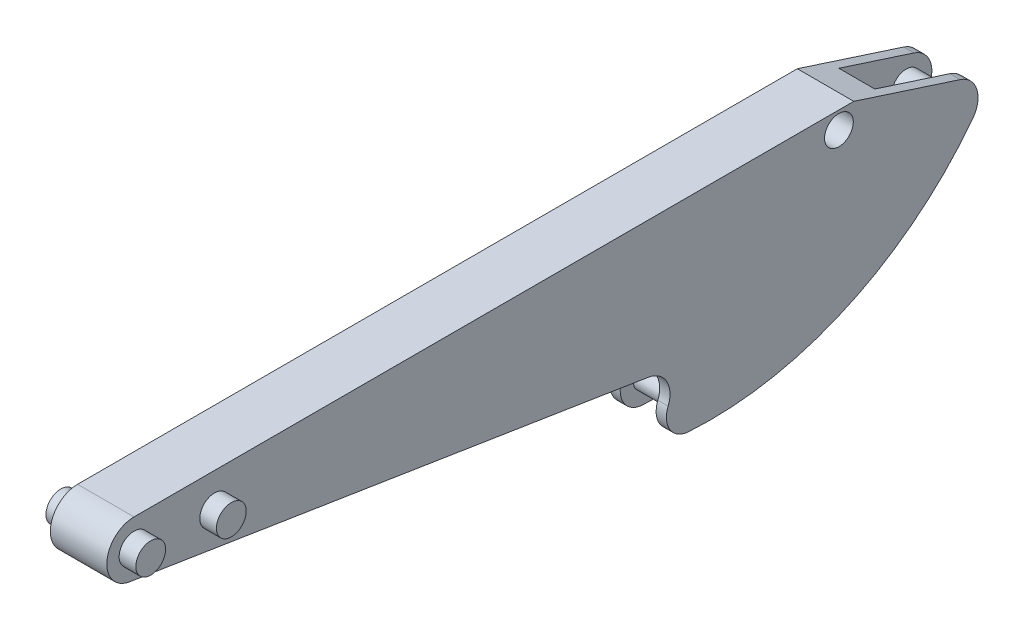
from build123d import *

# Parameters (mm, degrees)
SKETCH1_R           = 28
BOSS_EXTRUDE1_DEPTH = 55
CUT_EXTRUDE1_DEPTH  = 35
SKETCH3_R           = 28
SKETCH3_R_2         = 20
BOSS_EXTRUDE2_DEPTH = 35
SKETCH4_R           = 29
BOSS_EXTRUDE3_DEPTH = 87.5


with BuildPart() as part:
    # Sketch1 → Boss-Extrude1 (new, symmetric)
    with BuildSketch(Plane(origin=(0, 0, 0), x_dir=(0, 0, -1), z_dir=(1, 0, 0))):
        with BuildLine():
            ThreePointArc((1633.779443993, -91.870179926), (1388.538518192, -287.439228591), (1079.911873115, -343.474560585))
            ThreePointArc((1079.911873115, -343.474560585), (1044.034822803, -322.026545424), (1040.331298925, -280.391656157))
            ThreePointArc((1040.331298925, -280.391656157), (1037.457004109, -237.066241511), (1001.77399927, -212.326065873))
            Line((1001.77399927, -212.326065873), (-8.291026647, -52.347482052))
            ThreePointArc((-8.291026647, -52.347482052), (-52.836618688, 4.158332074), (0, 53))
            Line((0, 53), (1402, 53))
            Line((1402, 53), (1609.372117166, -14))
            ThreePointArc((1609.372117166, -14), (1641.711266017, -46.623901593), (1633.779443993, -91.870179926))
        make_face()
        with Locations((1373, 19)):
            Circle(SKETCH1_R, mode=Mode.SUBTRACT)
    extrude(amount=BOSS_EXTRUDE1_DEPTH, both=True)

    # Sketch2 → Cut-Extrude1 (cut, symmetric)
    with BuildSketch(Plane(origin=(0, 0, 0), x_dir=(0, 0, -1), z_dir=(1, 0, 0))):
        with BuildLine():
            Line((1462.900269506, 33.323690028), (1249.391694757, -251.544855987))
            Line((1249.391694757, -251.544855987), (1001.77399927, -212.326065873))
            ThreePointArc((1001.77399927, -212.326065873), (1037.457004109, -237.066241511), (1040.331298925, -280.391656157))
            ThreePointArc((1040.331298925, -280.391656157), (1044.034822803, -322.026545424), (1079.911873115, -343.474560585))
            ThreePointArc((1079.911873115, -343.474560585), (1388.538518192, -287.439228591), (1633.779443993, -91.870179926))
            ThreePointArc((1633.779443993, -91.870179926), (1641.711266017, -46.623901593), (1609.372117166, -14))
            Line((1609.372117166, -14), (1462.900269506, 33.323690028))
        make_face()
    extrude(amount=CUT_EXTRUDE1_DEPTH, both=True, mode=Mode.SUBTRACT)

    # Sketch3 → Boss-Extrude2 (add, symmetric)
    with BuildSketch(Plane(origin=(0, 0, 0), x_dir=(0, 0, -1), z_dir=(1, 0, 0))):
        with Locations((1594, -61.578335551)):
            Circle(SKETCH3_R)
        with Locations((1083, -297.578335551)):
            Circle(SKETCH3_R_2)
    extrude(amount=BOSS_EXTRUDE2_DEPTH, both=True)

    # Sketch4 → Boss-Extrude3 (add, symmetric)
    with BuildSketch(Plane(origin=(0, 0, 0), x_dir=(0, 0, -1), z_dir=(1, 0, 0))):
        Circle(SKETCH4_R)
        with Locations((157, -14)):
            Circle(SKETCH4_R)
    extrude(amount=BOSS_EXTRUDE3_DEPTH, both=True)


solid = part.part
